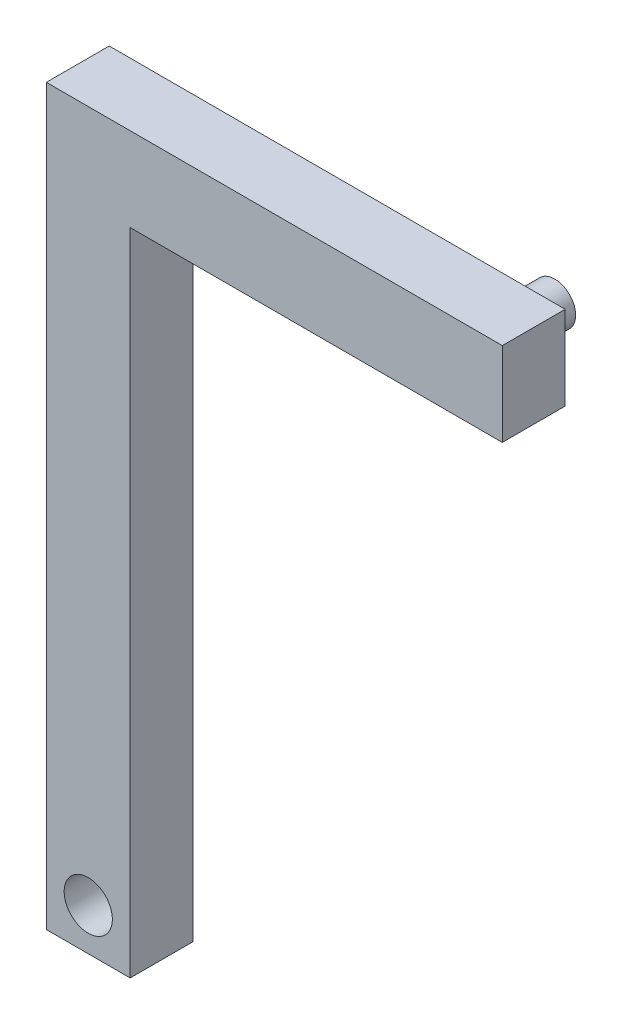
from build123d import *

# Parameters (mm, degrees)
CROQUIS1_W              = 22.5
CROQUIS1_H              = 4
SALIENTE_EXTRUIR1_DEPTH = 3
CROQUIS3_R              = 1
SALIENTE_EXTRUIR2_DEPTH = 2
CROQUIS5_W              = 4
CROQUIS5_H              = 31
CROQUIS5_R              = 1.05
SALIENTE_EXTRUIR3_DEPTH = 3
CROQUIS10_W             = 1.164205216
CROQUIS10_H             = 4.577506348
CORTAR_EXTRUIR4_DEPTH   = 42.907636536
CROQUIS12_R             = 1.15
CORTAR_EXTRUIR5_DEPTH   = 42.716303767


with BuildPart() as part:
    # Croquis1 → Saliente-Extruir1 (new body)
    with BuildSketch(Plane.XY):
        with Locations((11.25, -2)):
            Rectangle(CROQUIS1_W, CROQUIS1_H)
    extrude(amount=SALIENTE_EXTRUIR1_DEPTH)

    # Croquis3 → Saliente-Extruir2 (add)
    with BuildSketch(Plane(origin=(0, 0, 0), x_dir=(-1, 0, 0), z_dir=(0, 0, -1))):
        with Locations(Location((-20, -2, 0), (0, 0, 180))):
            Circle(CROQUIS3_R)
    extrude(amount=SALIENTE_EXTRUIR2_DEPTH)

    # Croquis5 → Saliente-Extruir3 (add)
    with BuildSketch(Plane(origin=(0, 0, 0), x_dir=(-1, 0, 0), z_dir=(0, 0, -1))):
        with Locations((-2.75, -19.5)):
            Rectangle(CROQUIS5_W, CROQUIS5_H)
        with Locations((-2.75, -33)):
            Circle(CROQUIS5_R, mode=Mode.SUBTRACT)
    extrude(amount=-SALIENTE_EXTRUIR3_DEPTH)

    # Croquis10 → Cortar-Extruir4 (cut, through all)
    with BuildSketch(Plane.XY.offset(3)):
        with Locations((0.167897392, -1.711246826)):
            Rectangle(CROQUIS10_W, CROQUIS10_H)
    extrude(amount=-CORTAR_EXTRUIR4_DEPTH, mode=Mode.SUBTRACT)

    # Croquis12 → Cortar-Extruir5 (cut, through all)
    with BuildSketch(Plane(origin=(0, 0, 0), x_dir=(-1, 0, 0), z_dir=(0, 0, -1))):
        with Locations((-2.75, -33)):
            Circle(CROQUIS12_R)
    extrude(amount=-CORTAR_EXTRUIR5_DEPTH, mode=Mode.SUBTRACT)


solid = part.part
